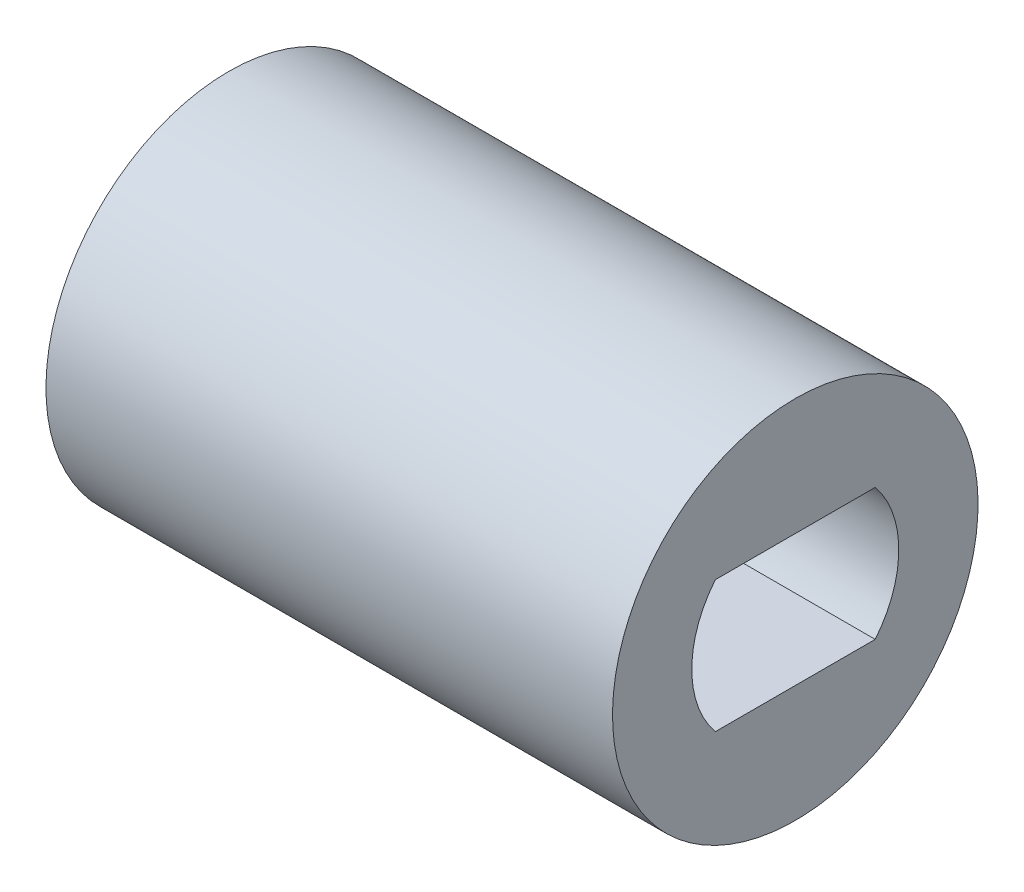
from build123d import *

# Parameters (mm, degrees)
CUT_EXTRUDE2_DEPTH = 6.604


with BuildPart() as part:
    # Sketch2 → Revolve1 (revolve)
    with BuildSketch(Plane.XY):
        Polygon((60.96, 6.35), (60.96, 0), (54.102, 0), (50.927, 3.175), (41.275, 3.175), (41.275, 6.35), align=None)
    revolve(axis=Axis((60.96, 0, 0), (-1, 0, 0)))

    # Sketch8 → Cut-Extrude2 (cut)
    with BuildSketch(Plane(origin=(60.96, 0, 0), x_dir=(0, 0, -1), z_dir=(1, 0, 0))):
        with BuildLine():
            Line((2.776494522, 2.286), (-2.776494522, 2.286))
            ThreePointArc((-2.776494522, 2.286), (-3.596486873, 0), (-2.776494522, -2.286))
            Line((-2.776494522, -2.286), (2.776494522, -2.286))
            ThreePointArc((2.776494522, -2.286), (3.385287575, -1.214308801), (3.596486873, 0))
            ThreePointArc((3.596486873, 0), (3.385287575, 1.214308801), (2.776494522, 2.286))
        make_face()
    extrude(amount=-CUT_EXTRUDE2_DEPTH, mode=Mode.SUBTRACT)


solid = part.part
